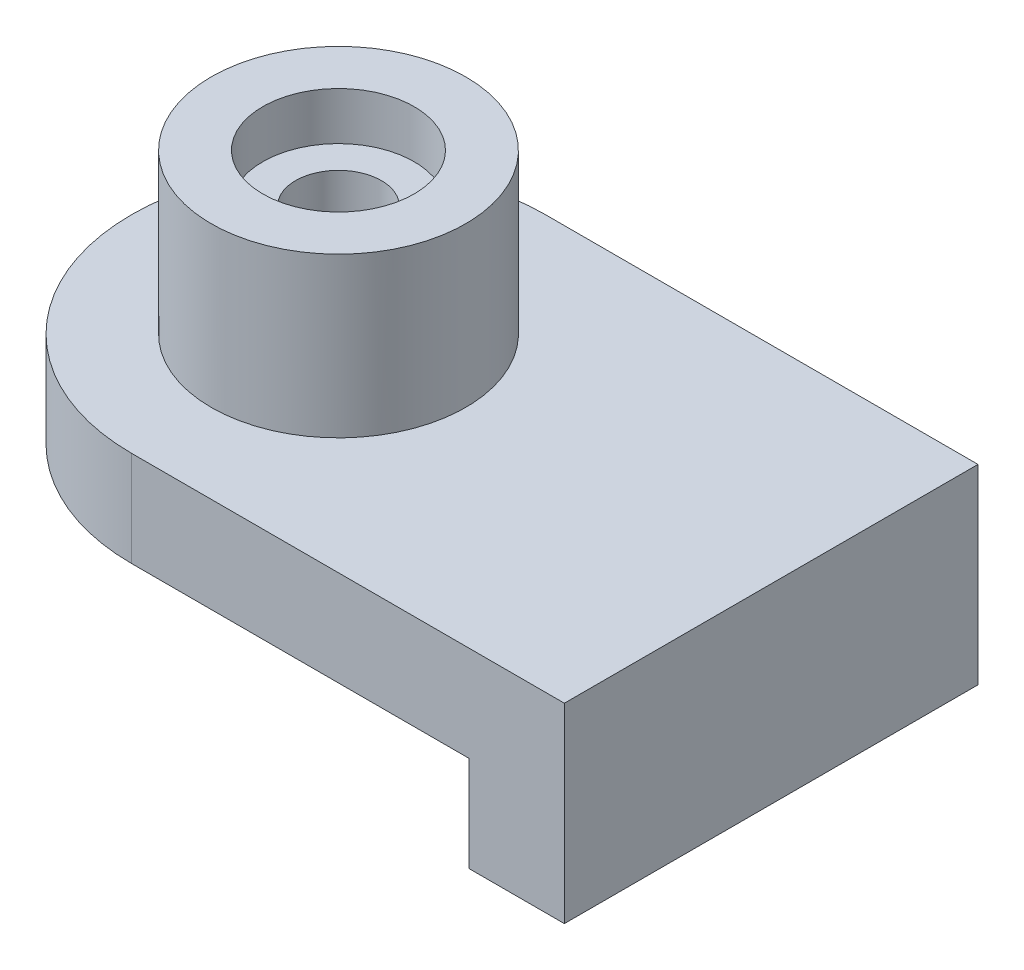
from build123d import *

# Parameters (mm, degrees)
BOSS_EXTRUDE1_DEPTH                                 = 65
BOSS_EXTRUDE2_START                                 = -15
SKETCH2_R                                           = 32.5
BOSS_EXTRUDE2_DEPTH                                 = 15
SKETCH3_R                                           = 20
BOSS_EXTRUDE4_DEPTH                                 = 25
CBORE_FOR_1_BINDING_HEAD_MACHINE_SCREW1_D           = 13.499999924
CBORE_FOR_1_BINDING_HEAD_MACHINE_SCREW1_CBORE_D     = 23.789999918
CBORE_FOR_1_BINDING_HEAD_MACHINE_SCREW1_CBORE_DEPTH = 7.499999986


with BuildPart() as part:
    # Sketch1 → Boss-Extrude1 (new body)
    with BuildSketch(Plane.XY):
        Polygon((0, 0), (0, 15), (68, 15), (68, -15), (53, -15), (53, 0), align=None)
    extrude(amount=BOSS_EXTRUDE1_DEPTH)

    # Sketch2 → Boss-Extrude2 (add)
    with BuildSketch(Plane(origin=(0, 15, 0), x_dir=(1, 0, 0), z_dir=(0, 1, 0)).offset(BOSS_EXTRUDE2_START)):
        with Locations((0, -32.5)):
            Circle(SKETCH2_R)
    extrude(amount=BOSS_EXTRUDE2_DEPTH)

    # Sketch3 → Boss-Extrude4 (add)
    with BuildSketch(Plane(origin=(0, 15, 0), x_dir=(1, 0, 0), z_dir=(0, 1, 0))):
        with Locations(Location((0, -32.5, 0), (0, 0, 90))):
            Circle(SKETCH3_R)
    extrude(amount=BOSS_EXTRUDE4_DEPTH)

    # CBORE for #1 Binding Head Machine Screw1 (through all)
    with Locations(Plane(origin=(0, 40, 0), x_dir=(1, 0, 0), z_dir=(0, 1, 0))):
        with Locations((0, -32.5)):
            CounterBoreHole(CBORE_FOR_1_BINDING_HEAD_MACHINE_SCREW1_D / 2, CBORE_FOR_1_BINDING_HEAD_MACHINE_SCREW1_CBORE_D / 2, CBORE_FOR_1_BINDING_HEAD_MACHINE_SCREW1_CBORE_DEPTH)


solid = part.part
